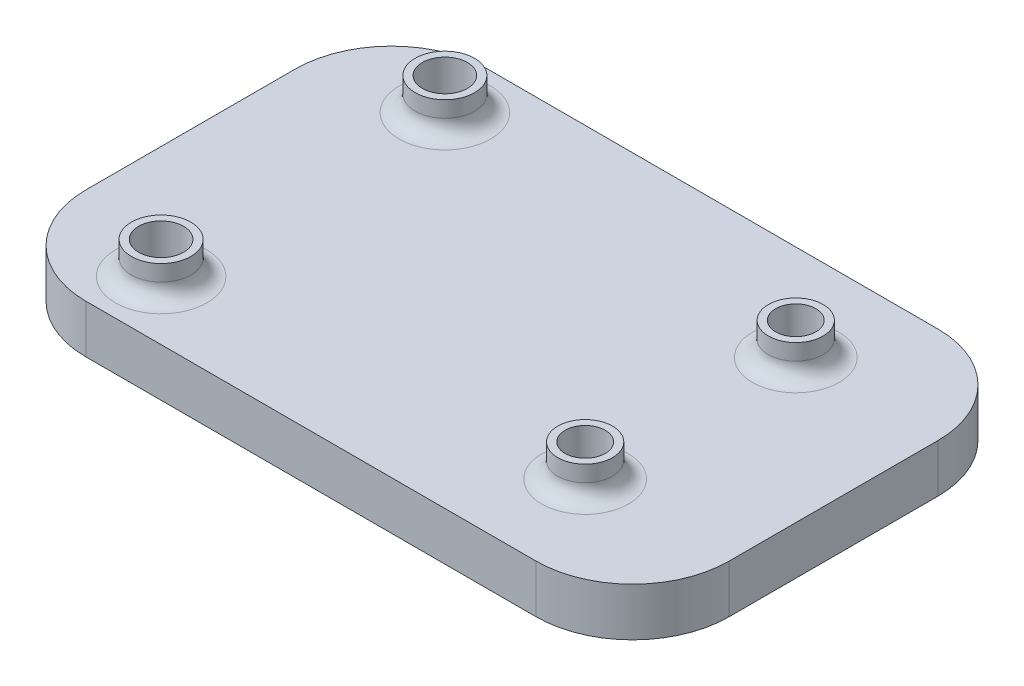
from build123d import *

# Parameters (mm, degrees)
SKETCH1_W           = 40
SKETCH1_H           = 25
SKETCH1_R           = 1.4
BOSS_EXTRUDE1_DEPTH = 3
SKETCH2_R           = 1.25
CUT_EXTRUDE1_DEPTH  = 24.774986856
SKETCH4_R           = 1.85
SKETCH4_R_2         = 1.4
SKETCH4_R_3         = 1.7
SKETCH4_R_4         = 1.25
BOSS_EXTRUDE2_DEPTH = 2
FILLET1_R           = 1
CUT_EXTRUDE2_DEPTH  = 2
CUT_EXTRUDE3_DEPTH  = 1.4
FILLET2_R           = 6


with BuildPart() as part:
    # Sketch1 → Boss-Extrude1 (new body)
    with BuildSketch(Plane(origin=(0, 0, 0), x_dir=(1, 0, 0), z_dir=(0, 1, 0))):
        Rectangle(SKETCH1_W, SKETCH1_H)
        with Locations(Location((-13, 8.825, 0), (0, 0, 270))):
            Circle(SKETCH1_R, mode=Mode.SUBTRACT)
        with Locations(Location((-13, -8.825, 0), (0, 0, 270))):
            Circle(SKETCH1_R, mode=Mode.SUBTRACT)
    extrude(amount=BOSS_EXTRUDE1_DEPTH)

    # Sketch2 → Cut-Extrude1 (cut, through all)
    with BuildSketch(Plane(origin=(0, 3, 0), x_dir=(1, 0, 0), z_dir=(0, 1, 0))):
        with Locations(Location((11.1, 6.55, 0), (0, 0, 270))):
            Circle(SKETCH2_R)
        with Locations(Location((11.1, -6.55, 0), (0, 0, 90))):
            Circle(SKETCH2_R)
    extrude(amount=-CUT_EXTRUDE1_DEPTH, mode=Mode.SUBTRACT)

    # Sketch4 → Boss-Extrude2 (add)
    # profile 1 of 4: a face of its own
    with BuildSketch(Plane(origin=(0, 3, 0), x_dir=(1, 0, 0), z_dir=(0, 1, 0))):
        with Locations(Location((-13, 8.825, 0), (0, 0, 270))):
            Circle(SKETCH4_R)
        with Locations(Location((-13, 8.825, 0), (0, 0, 270))):
            Circle(SKETCH4_R_2, mode=Mode.SUBTRACT)
    # profile 2 of 4: a face of its own
    with BuildSketch(Plane(origin=(0, 3, 0), x_dir=(1, 0, 0), z_dir=(0, 1, 0))):
        with Locations(Location((11.1, 6.55, 0), (0, 0, 270))):
            Circle(SKETCH4_R_3)
        with Locations(Location((11.1, 6.55, 0), (0, 0, 270))):
            Circle(SKETCH4_R_4, mode=Mode.SUBTRACT)
    # profile 3 of 4: a face of its own
    with BuildSketch(Plane(origin=(0, 3, 0), x_dir=(1, 0, 0), z_dir=(0, 1, 0))):
        with Locations(Location((11.1, -6.55, 0), (0, 0, 270))):
            Circle(SKETCH4_R_3)
        with Locations(Location((11.1, -6.55, 0), (0, 0, 270))):
            Circle(SKETCH4_R_4, mode=Mode.SUBTRACT)
    # profile 4 of 4: a face of its own
    with BuildSketch(Plane(origin=(0, 3, 0), x_dir=(1, 0, 0), z_dir=(0, 1, 0))):
        with Locations(Location((-13, -8.825, 0), (0, 0, 270))):
            Circle(SKETCH4_R)
        with Locations(Location((-13, -8.825, 0), (0, 0, 270))):
            Circle(SKETCH4_R_2, mode=Mode.SUBTRACT)
    extrude(amount=BOSS_EXTRUDE2_DEPTH)

    # Fillet1
    fillet1_edges = [part.edges().sort_by_distance(p)[0] for p in [
        (-13, 3, -10.675),
        (11.1, 3, -8.25),
        (11.1, 3, 4.85),
        (-13, 3, 6.975),
    ]]
    fillet(fillet1_edges, radius=FILLET1_R)

    # Sketch5 → Cut-Extrude2 (cut)
    with BuildSketch(Plane.XZ):
        Polygon((-11.470021787, 6.175), (-9.940043573, 8.825), (-11.470021787, 11.475), (-14.529978213, 11.475), (-16.059956427, 8.825), (-14.529978213, 6.175), align=None)
        Polygon((-11.470021787, -11.475), (-9.940043573, -8.825), (-11.470021787, -6.175), (-14.529978213, -6.175), (-16.059956427, -8.825), (-14.529978213, -11.475), align=None)
    extrude(amount=-CUT_EXTRUDE2_DEPTH, mode=Mode.SUBTRACT)

    # Sketch6 → Cut-Extrude3 (cut)
    with BuildSketch(Plane.XZ):
        Polygon((12.283568052, 4.5), (13.467136104, 6.55), (12.283568052, 8.6), (9.916431948, 8.6), (8.732863896, 6.55), (9.916431948, 4.5), align=None)
        Polygon((12.283568052, -8.6), (13.467136104, -6.55), (12.283568052, -4.5), (9.916431948, -4.5), (8.732863896, -6.55), (9.916431948, -8.6), align=None)
    extrude(amount=-CUT_EXTRUDE3_DEPTH, mode=Mode.SUBTRACT)

    # Fillet2
    fillet2_edges = [part.edges().sort_by_distance(p)[0] for p in [
        (-20, 1.5, -12.5),
        (20, 1.5, -12.5),
        (20, 1.5, 12.5),
        (-20, 1.5, 12.5),
    ]]
    fillet(fillet2_edges, radius=FILLET2_R)


solid = part.part
